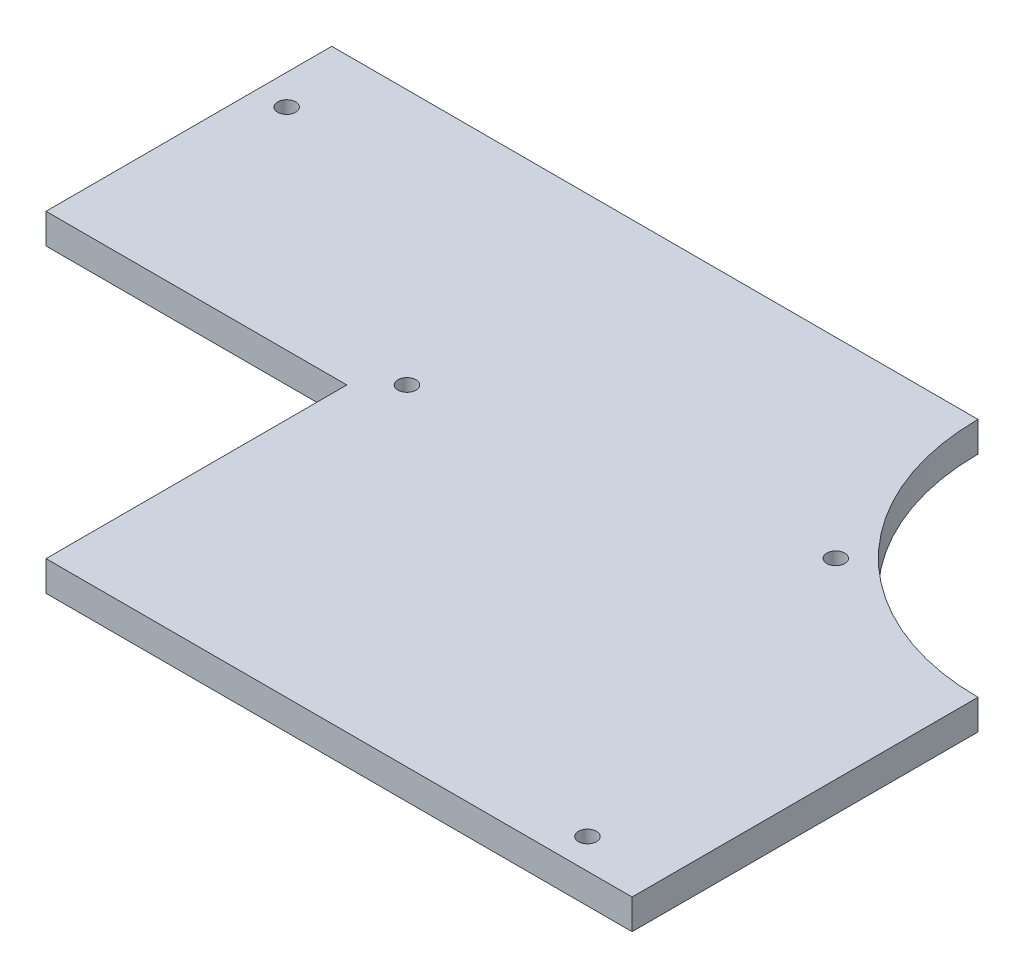
from build123d import *

# Parameters (mm, degrees)
ESQUISSE1_R        = 1.5
BOSS_EXTRU_1_DEPTH = 5


with BuildPart() as part:
    # Esquisse1 → Boss.-Extru.1 (new body)
    with BuildSketch(Plane(origin=(0, 0, 0), x_dir=(1, 0, 0), z_dir=(0, 1, 0))):
        with BuildLine():
            Line((-97.415, -97.415), (0, -97.415))
            Line((0, -97.415), (0, -39.915))
            ThreePointArc((0, -39.915), (-28.284271247, -28.199271247), (-40, 0.085))
            Line((-40, 0.085), (-147.415, 0.085))
            Line((-147.415, 0.085), (-147.415, -47.415))
            Line((-147.415, -47.415), (-97.415, -47.415))
            Line((-97.415, -47.415), (-97.415, -97.415))
        make_face()
        with Locations(Location((-12.415, -92.415, 0), (0, 0, 270))):
            Circle(ESQUISSE1_R, mode=Mode.SUBTRACT)
        with Locations(Location((-92.415, -42.415, 0), (0, 0, 270))):
            Circle(ESQUISSE1_R, mode=Mode.SUBTRACT)
        with Locations(Location((-142.415, -12.415, 0), (0, 0, 270))):
            Circle(ESQUISSE1_R, mode=Mode.SUBTRACT)
        with Locations(Location((-31.819805153, -31.734805153, 0), (0, 0, 270))):
            Circle(ESQUISSE1_R, mode=Mode.SUBTRACT)
    extrude(amount=BOSS_EXTRU_1_DEPTH)


solid = part.part
